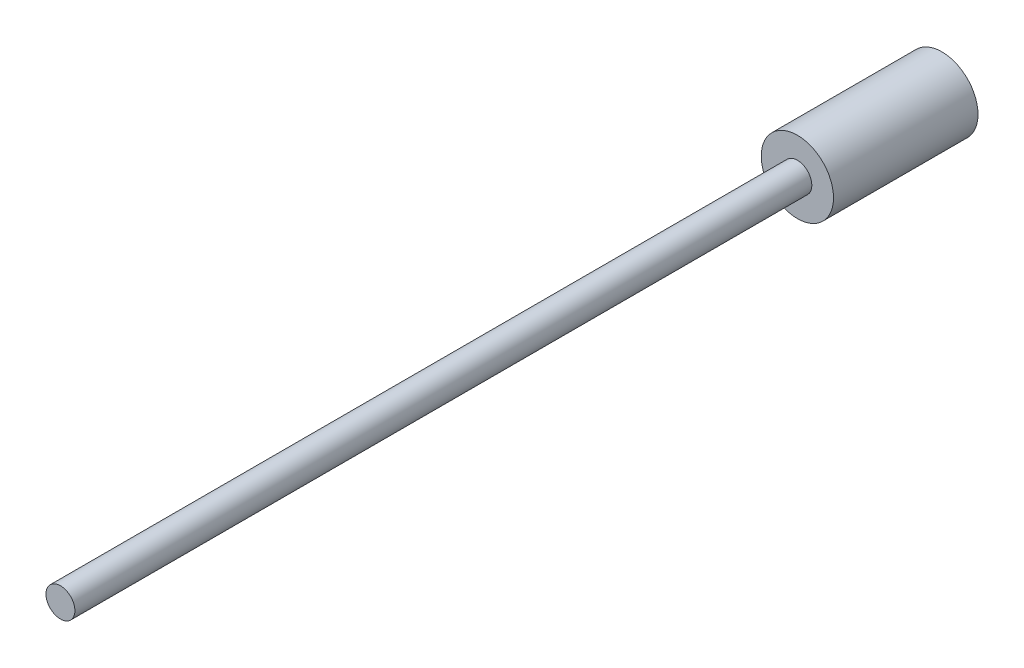
from build123d import *

# Parameters (mm, degrees)
SKETCH1_R           = 25
BOSS_EXTRUDE1_DEPTH = 100
SKETCH2_R           = 10
BOSS_EXTRUDE2_DEPTH = 510


with BuildPart() as part:
    # Sketch1 → Boss-Extrude1 (new body)
    with BuildSketch(Plane.XY):
        Circle(SKETCH1_R)
    extrude(amount=-BOSS_EXTRUDE1_DEPTH)

    # Sketch2 → Boss-Extrude2 (add)
    with BuildSketch(Plane.XY):
        Circle(SKETCH2_R)
    extrude(amount=BOSS_EXTRUDE2_DEPTH)


solid = part.part
